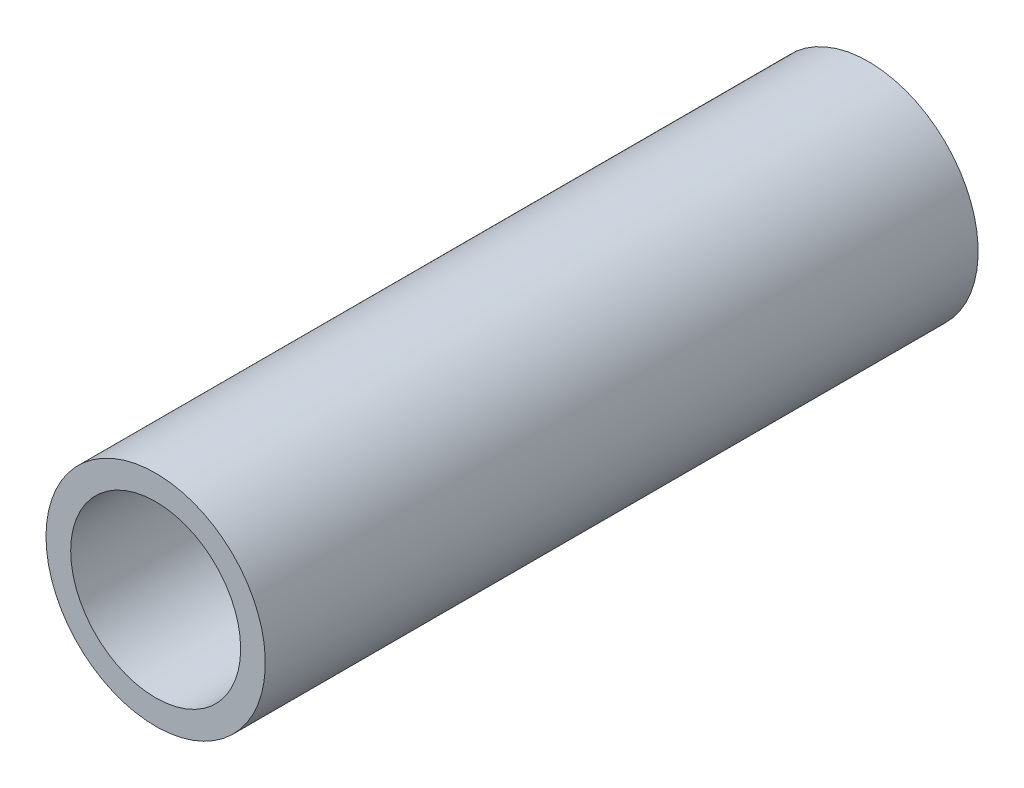
from build123d import *

# Parameters (mm, degrees)
SKETCH_1_R      = 1
SKETCH_1_R_2    = 0.775
EXTRUDE_1_DEPTH = 6.5


with BuildPart() as part:
    # Эскиз1 → Бобышка-Вытянуть1 (new body)
    with BuildSketch(Plane.XY):
        with Locations(Location((0, 0, 0), (0, 0, 180))):
            Circle(SKETCH_1_R)
        with Locations(Location((0, 0, 0), (0, 0, 180))):
            Circle(SKETCH_1_R_2, mode=Mode.SUBTRACT)
    extrude(amount=EXTRUDE_1_DEPTH)


solid = part.part
